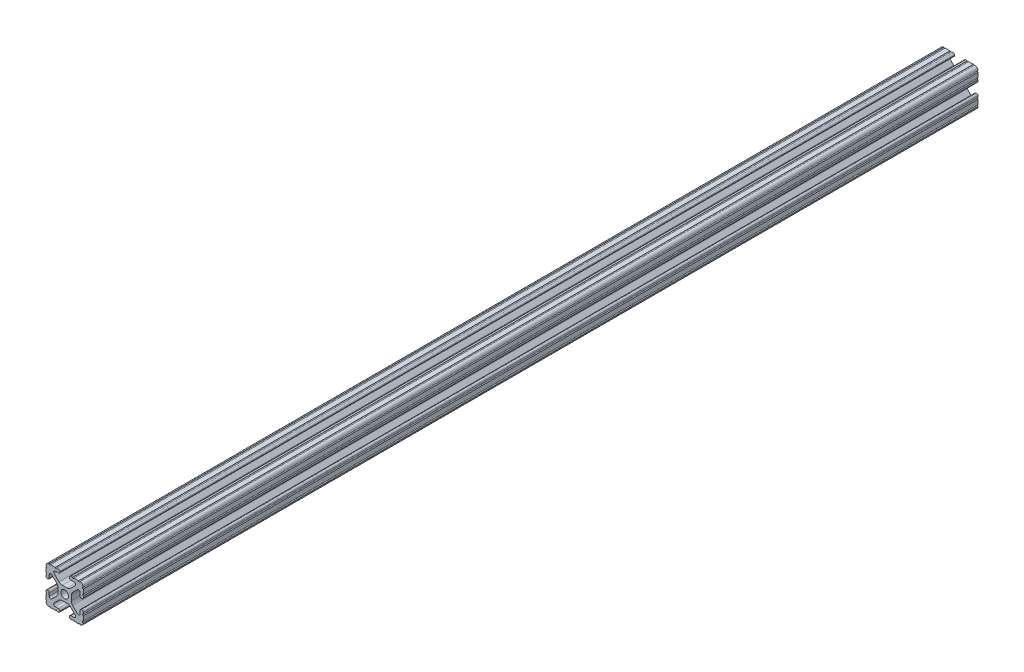
from build123d import *

# Parameters (mm, degrees)
SKETCH1_R           = 2.6035
BOSS_EXTRUDE1_DEPTH = 304.8


with BuildPart() as part:
    # Sketch1 → Boss-Extrude1 (new, symmetric)
    with BuildSketch(Plane.XY):
        with BuildLine():
            Line((-7.179650497, -8.645192506), (-3.952270251, -5.423690499))
            ThreePointArc((-3.952270251, -5.423690499), (-2.922936451, -4.736929036), (-1.709253557, -4.4958))
            Line((-1.709253557, -4.4958), (1.709253557, -4.4958))
            ThreePointArc((1.709253557, -4.4958), (2.922936451, -4.736929036), (3.952270251, -5.423690499))
            Line((3.952270251, -5.423690499), (7.179650497, -8.645192506))
            ThreePointArc((7.179650497, -8.645192506), (7.41473083, -9.822813117), (6.416408329, -10.4902))
            Line((6.416408329, -10.4902), (4.287512407, -10.4902))
            ThreePointArc((4.287512407, -10.4902), (3.54574862, -10.79744862), (3.2385, -11.539212407))
            Line((3.2385, -11.539212407), (3.2385, -11.650987593))
            ThreePointArc((3.2385, -11.650987593), (3.54574862, -12.39275138), (4.287512407, -12.7))
            Line((4.287512407, -12.7), (5.317126718, -12.7))
            ThreePointArc((5.317126718, -12.7), (5.825126718, -12.192), (6.333126718, -12.7))
            Line((6.333126718, -12.7), (9.550443118, -12.7))
            ThreePointArc((9.550443118, -12.7), (10.058366869, -12.192000006), (10.566443095, -12.699847501))
            ThreePointArc((10.566443095, -12.699847501), (12.082537762, -12.08250727), (12.699846982, -10.566399977))
            ThreePointArc((12.699846982, -10.566399977), (12.192000006, -10.058323491), (12.7, -9.5504))
            Line((12.7, -9.5504), (12.7, -6.3330836))
            ThreePointArc((12.7, -6.3330836), (12.192, -5.8250836), (12.7, -5.3170836))
            Line((12.7, -5.3170836), (12.7, -4.287469289))
            ThreePointArc((12.7, -4.287469289), (12.39275138, -3.545705502), (11.650987593, -3.238456882))
            Line((11.650987593, -3.238456882), (11.539212407, -3.238456882))
            ThreePointArc((11.539212407, -3.238456882), (10.79744862, -3.545705502), (10.4902, -4.287469289))
            Line((10.4902, -4.287469289), (10.4902, -6.402089023))
            ThreePointArc((10.4902, -6.402089023), (9.856505071, -7.351067942), (8.737131347, -7.129408934))
            Line((8.737131347, -7.129408934), (5.441005833, -3.840816462))
            ThreePointArc((5.441005833, -3.840816462), (4.750877967, -2.809883091), (4.5085, -1.593185507))
            Line((4.5085, -1.593185507), (4.5085, 1.593185507))
            ThreePointArc((4.5085, 1.593185507), (4.750877967, 2.809883091), (5.441005833, 3.840816462))
            Line((5.441005833, 3.840816462), (8.737131347, 7.129408934))
            ThreePointArc((8.737131347, 7.129408934), (9.856505071, 7.351067942), (10.4902, 6.402089023))
            Line((10.4902, 6.402089023), (10.4902, 4.287469289))
            ThreePointArc((10.4902, 4.287469289), (10.79744862, 3.545705502), (11.539212407, 3.238456882))
            Line((11.539212407, 3.238456882), (11.650987593, 3.238456882))
            ThreePointArc((11.650987593, 3.238456882), (12.39275138, 3.545705502), (12.7, 4.287469289))
            Line((12.7, 4.287469289), (12.7, 5.3170836))
            ThreePointArc((12.7, 5.3170836), (12.192, 5.8250836), (12.7, 6.3330836))
            Line((12.7, 6.3330836), (12.7, 9.5504))
            ThreePointArc((12.7, 9.5504), (12.192000006, 10.058323491), (12.699846982, 10.566399977))
            ThreePointArc((12.699846982, 10.566399977), (12.082537762, 12.08250727), (10.566443095, 12.699847501))
            ThreePointArc((10.566443095, 12.699847501), (10.058366869, 12.192000006), (9.550443118, 12.7))
            Line((9.550443118, 12.7), (6.333126718, 12.7))
            ThreePointArc((6.333126718, 12.7), (5.825126718, 12.192), (5.317126718, 12.7))
            Line((5.317126718, 12.7), (4.287512407, 12.7))
            ThreePointArc((4.287512407, 12.7), (3.54574862, 12.39275138), (3.2385, 11.650987593))
            Line((3.2385, 11.650987593), (3.2385, 11.539212407))
            ThreePointArc((3.2385, 11.539212407), (3.54574862, 10.79744862), (4.287512407, 10.4902))
            Line((4.287512407, 10.4902), (6.476788598, 10.4902))
            ThreePointArc((6.476788598, 10.4902), (7.432222385, 9.85140422), (7.207036008, 8.724370562))
            Line((7.207036008, 8.724370562), (3.898272566, 5.423169045))
            ThreePointArc((3.898272566, 5.423169045), (2.869120213, 4.736787962), (1.655778399, 4.4958))
            Line((1.655778399, 4.4958), (-1.655778399, 4.4958))
            ThreePointArc((-1.655778399, 4.4958), (-2.869120213, 4.736787962), (-3.898272566, 5.423169045))
            Line((-3.898272566, 5.423169045), (-7.207036008, 8.724370562))
            ThreePointArc((-7.207036008, 8.724370562), (-7.432222385, 9.85140422), (-6.476788598, 10.4902))
            Line((-6.476788598, 10.4902), (-4.287512407, 10.4902))
            ThreePointArc((-4.287512407, 10.4902), (-3.54574862, 10.79744862), (-3.2385, 11.539212407))
            Line((-3.2385, 11.539212407), (-3.2385, 11.650987593))
            ThreePointArc((-3.2385, 11.650987593), (-3.54574862, 12.39275138), (-4.287512407, 12.7))
            Line((-4.287512407, 12.7), (-5.317126718, 12.7))
            ThreePointArc((-5.317126718, 12.7), (-5.825126718, 12.192), (-6.333126718, 12.7))
            Line((-6.333126718, 12.7), (-9.550443118, 12.7))
            ThreePointArc((-9.550443118, 12.7), (-10.058366869, 12.192000006), (-10.566443095, 12.699847501))
            ThreePointArc((-10.566443095, 12.699847501), (-12.082537762, 12.08250727), (-12.699846982, 10.566399977))
            ThreePointArc((-12.699846982, 10.566399977), (-12.192000006, 10.058323491), (-12.7, 9.5504))
            Line((-12.7, 9.5504), (-12.7, 6.3330836))
            ThreePointArc((-12.7, 6.3330836), (-12.192, 5.8250836), (-12.7, 5.3170836))
            Line((-12.7, 5.3170836), (-12.7, 4.287469289))
            ThreePointArc((-12.7, 4.287469289), (-12.39275138, 3.545705502), (-11.650987593, 3.238456882))
            Line((-11.650987593, 3.238456882), (-11.539212407, 3.238456882))
            ThreePointArc((-11.539212407, 3.238456882), (-10.79744862, 3.545705502), (-10.4902, 4.287469289))
            Line((-10.4902, 4.287469289), (-10.4902, 6.402089023))
            ThreePointArc((-10.4902, 6.402089023), (-9.856505071, 7.351067942), (-8.737131347, 7.129408934))
            Line((-8.737131347, 7.129408934), (-5.441005833, 3.840816462))
            ThreePointArc((-5.441005833, 3.840816462), (-4.750877967, 2.809883091), (-4.5085, 1.593185507))
            Line((-4.5085, 1.593185507), (-4.5085, -1.593185507))
            ThreePointArc((-4.5085, -1.593185507), (-4.750877967, -2.809883091), (-5.441005833, -3.840816462))
            Line((-5.441005833, -3.840816462), (-8.737131347, -7.129408934))
            ThreePointArc((-8.737131347, -7.129408934), (-9.856505071, -7.351067942), (-10.4902, -6.402089023))
            Line((-10.4902, -6.402089023), (-10.4902, -4.287469289))
            ThreePointArc((-10.4902, -4.287469289), (-10.79744862, -3.545705502), (-11.539212407, -3.238456882))
            Line((-11.539212407, -3.238456882), (-11.650987593, -3.238456882))
            ThreePointArc((-11.650987593, -3.238456882), (-12.39275138, -3.545705502), (-12.7, -4.287469289))
            Line((-12.7, -4.287469289), (-12.7, -5.3170836))
            ThreePointArc((-12.7, -5.3170836), (-12.192, -5.8250836), (-12.7, -6.3330836))
            Line((-12.7, -6.3330836), (-12.7, -9.5504))
            ThreePointArc((-12.7, -9.5504), (-12.192000006, -10.058323491), (-12.699846982, -10.566399977))
            ThreePointArc((-12.699846982, -10.566399977), (-12.082537762, -12.08250727), (-10.566443095, -12.699847501))
            ThreePointArc((-10.566443095, -12.699847501), (-10.058366869, -12.192000006), (-9.550443118, -12.7))
            Line((-9.550443118, -12.7), (-6.333126718, -12.7))
            ThreePointArc((-6.333126718, -12.7), (-5.825126718, -12.192), (-5.317126718, -12.7))
            Line((-5.317126718, -12.7), (-4.287512407, -12.7))
            ThreePointArc((-4.287512407, -12.7), (-3.54574862, -12.39275138), (-3.2385, -11.650987593))
            Line((-3.2385, -11.650987593), (-3.2385, -11.539212407))
            ThreePointArc((-3.2385, -11.539212407), (-3.54574862, -10.79744862), (-4.287512407, -10.4902))
            Line((-4.287512407, -10.4902), (-6.416408329, -10.4902))
            ThreePointArc((-6.416408329, -10.4902), (-7.41473083, -9.822813117), (-7.179650497, -8.645192506))
        make_face()
        with Locations(Location((0, 0, 0), (0, 0, 180))):
            Circle(SKETCH1_R, mode=Mode.SUBTRACT)
    extrude(amount=BOSS_EXTRUDE1_DEPTH, both=True)


solid = part.part
